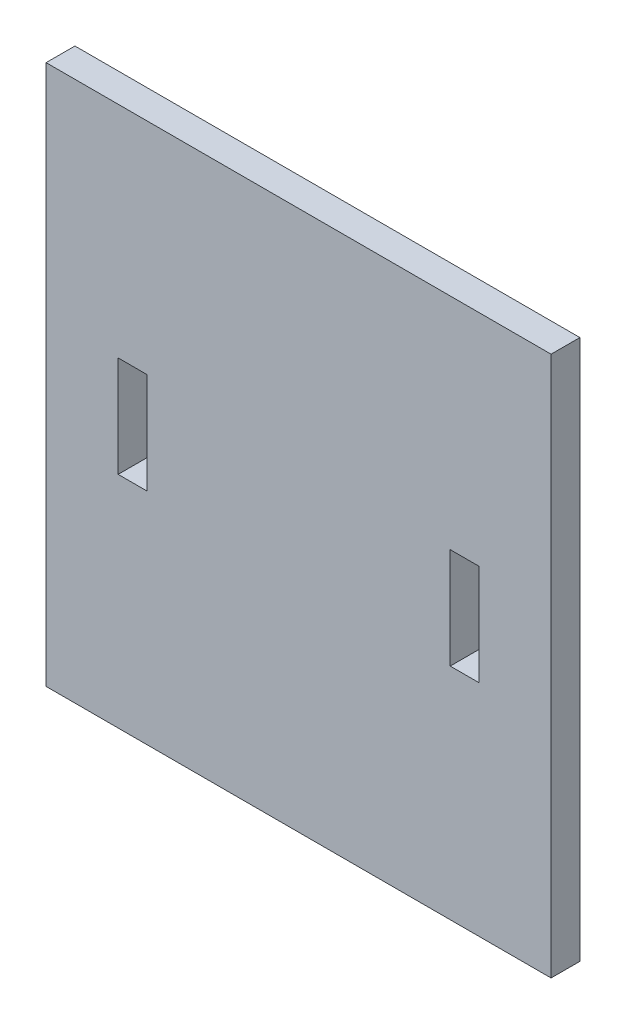
from build123d import *

# Parameters (mm, degrees)
CROQUIS1_W              = 70.1
CROQUIS1_H              = 75
CROQUIS1_W_2            = 4
CROQUIS1_H_2            = 14
SALIENTE_EXTRUIR1_DEPTH = 4


with BuildPart() as part:
    # Croquis1 → Saliente-Extruir1 (new body)
    with BuildSketch(Plane.XY):
        Rectangle(CROQUIS1_W, CROQUIS1_H)
        with Locations((-23.05, 0)):
            Rectangle(CROQUIS1_W_2, CROQUIS1_H_2, mode=Mode.SUBTRACT)
        with Locations((23.05, 0)):
            Rectangle(CROQUIS1_W_2, CROQUIS1_H_2, mode=Mode.SUBTRACT)
    extrude(amount=SALIENTE_EXTRUIR1_DEPTH)


solid = part.part
